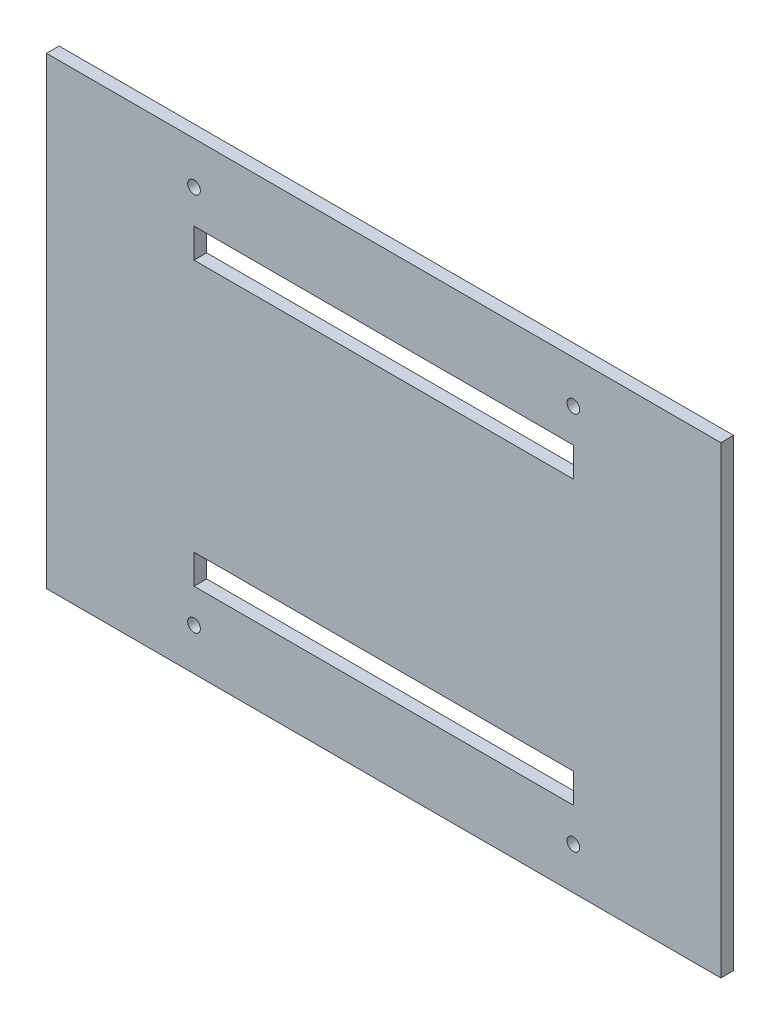
from build123d import *

# Parameters (mm, degrees)
SKETCH1_W           = 160
SKETCH1_H           = 110
SKETCH1_R           = 1.5
SKETCH1_W_2         = 90
SKETCH1_H_2         = 7
BOSS_EXTRUDE1_DEPTH = 3


with BuildPart() as part:
    # Sketch1 → Boss-Extrude1 (new body)
    with BuildSketch(Plane.XY):
        Rectangle(SKETCH1_W, SKETCH1_H)
        with Locations((45, 45)):
            Circle(SKETCH1_R, mode=Mode.SUBTRACT)
        with Locations((-45, 45)):
            Circle(SKETCH1_R, mode=Mode.SUBTRACT)
        with Locations((-45, -45)):
            Circle(SKETCH1_R, mode=Mode.SUBTRACT)
        with Locations((45, -45)):
            Circle(SKETCH1_R, mode=Mode.SUBTRACT)
        with Locations((0, 33.5)):
            Rectangle(SKETCH1_W_2, SKETCH1_H_2, mode=Mode.SUBTRACT)
        with Locations((0, -33.5)):
            Rectangle(SKETCH1_W_2, SKETCH1_H_2, mode=Mode.SUBTRACT)
    extrude(amount=BOSS_EXTRUDE1_DEPTH)


solid = part.part
